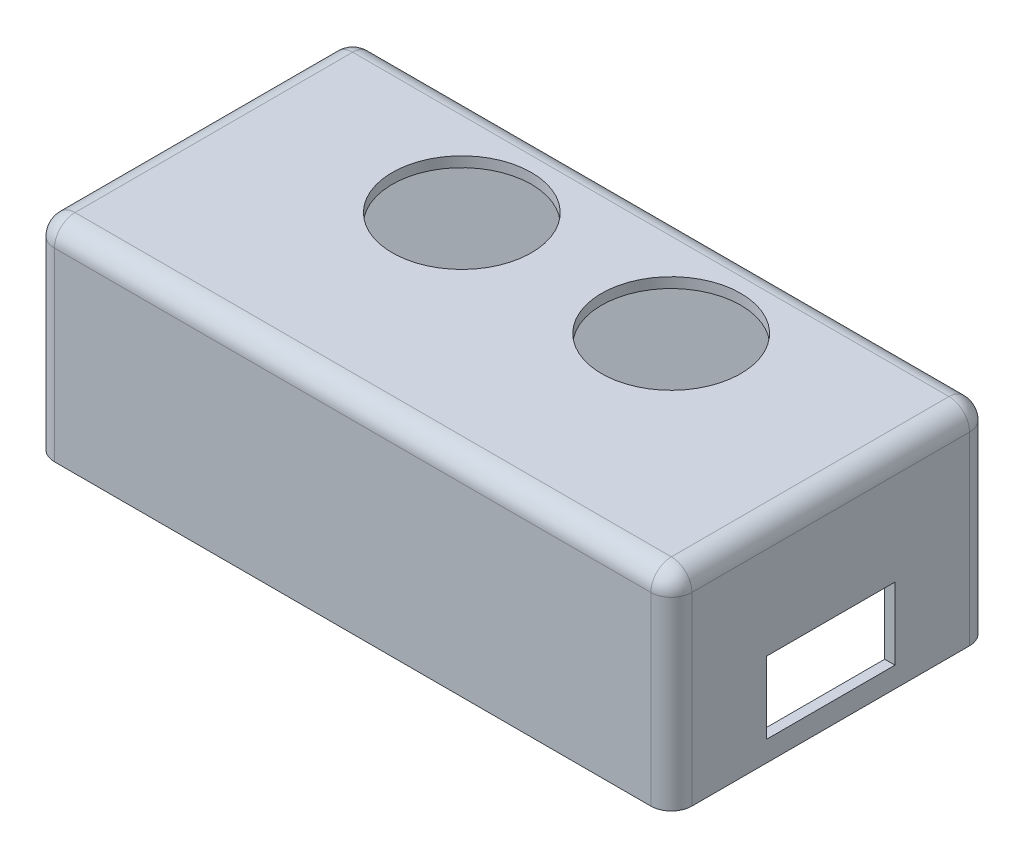
from build123d import *

# Parameters (mm, degrees)
SKETCH1_W           = 78.74
SKETCH1_H           = 39.37
BOSS_EXTRUDE1_DEPTH = 25.4
FILLET1_R           = 2.54
SHELL1_T            = -1.27
SKETCH2_R           = 8.5979
CUT_EXTRUDE1_DEPTH  = 92.281111956
SKETCH3_W           = 15.875
SKETCH3_H           = 8.89
CUT_EXTRUDE2_DEPTH  = 1.27


with BuildPart() as part:
    # Sketch1 → Boss-Extrude1 (new body)
    with BuildSketch(Plane(origin=(0, 0, 0), x_dir=(1, 0, 0), z_dir=(0, 1, 0))):
        with Locations((-39.37, 19.685)):
            Rectangle(SKETCH1_W, SKETCH1_H)
    extrude(amount=BOSS_EXTRUDE1_DEPTH)

    # Fillet1
    fillet1_edges = [part.edges().sort_by_distance(p)[0] for p in [
        (-78.74, 25.4, -19.685),
        (-39.37, 25.4, 0),
        (0, 25.4, -19.685),
        (-39.37, 25.4, -39.37),
        (0, 12.7, 0),
        (-78.74, 12.7, 0),
        (-78.74, 12.7, -39.37),
        (0, 12.7, -39.37),
    ]]
    fillet(fillet1_edges, radius=FILLET1_R)

    # Shell1
    shell1_openings = [part.faces().sort_by_distance(p)[0] for p in [
        (-39.37, 0, -19.685),
    ]]
    offset(amount=SHELL1_T, openings=shell1_openings, kind=Kind.INTERSECTION)

    # Sketch2 → Cut-Extrude1 (cut, through all)
    with BuildSketch(Plane.XZ.offset(-24.13)):
        with Locations(Location((-52.2986, -26.416, 0), (0, 0, 270))):
            Circle(SKETCH2_R)
        with Locations(Location((-26.4414, -26.416, 0), (0, 0, 270))):
            Circle(SKETCH2_R)
    extrude(amount=-CUT_EXTRUDE1_DEPTH, mode=Mode.SUBTRACT)

    # Sketch3 → Cut-Extrude2 (cut)
    with BuildSketch(Plane(origin=(0, 0, 0), x_dir=(0, 0, -1), z_dir=(1, 0, 0))):
        with Locations((19.685, 6.985)):
            Rectangle(SKETCH3_W, SKETCH3_H)
    extrude(amount=-CUT_EXTRUDE2_DEPTH, mode=Mode.SUBTRACT)


solid = part.part
